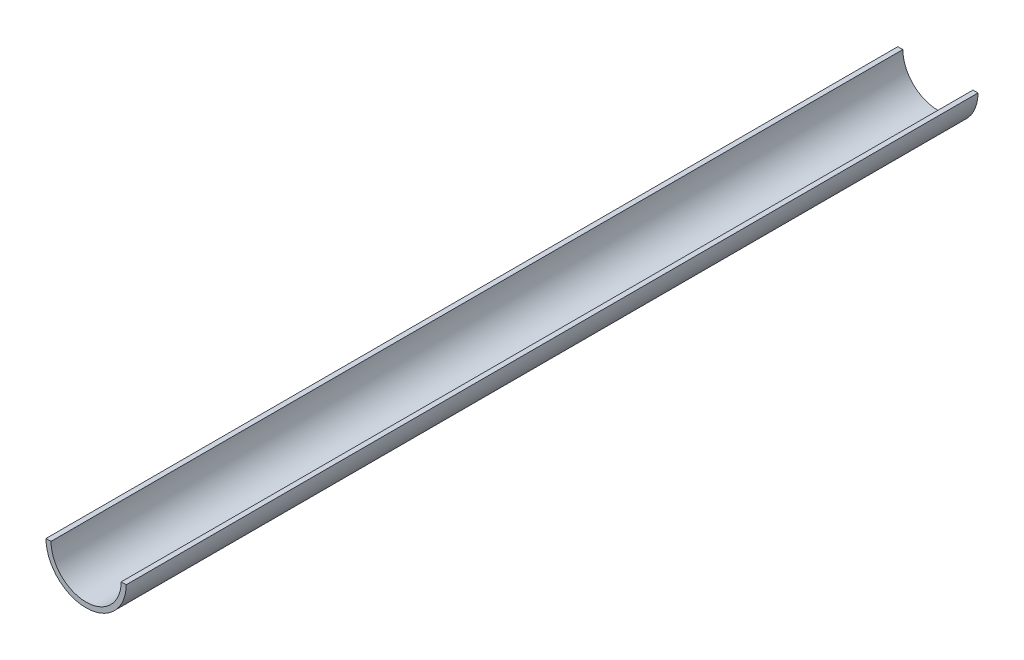
from build123d import *

# Parameters (mm, degrees)
SKETCH1_R           = 25.4
SKETCH1_R_2         = 22.225
BOSS_EXTRUDE1_DEPTH = 914.4
CUT_EXTRUDE1_START  = -539.75
SKETCH2_R           = 25.4
CUT_EXTRUDE1_DEPTH  = 376.35528356
CUT_EXTRUDE3_DEPTH  = 541.943973531


with BuildPart() as part:
    # Sketch1 → Boss-Extrude1 (new body)
    with BuildSketch(Plane.XY):
        Circle(SKETCH1_R)
        Circle(SKETCH1_R_2, mode=Mode.SUBTRACT)
    extrude(amount=BOSS_EXTRUDE1_DEPTH)

    # Sketch2 → Cut-Extrude1 (cut, through all)
    with BuildSketch(Plane(origin=(0, 0, 0), x_dir=(-1, 0, 0), z_dir=(0, 0, -1)).offset(CUT_EXTRUDE1_START)):
        Circle(SKETCH2_R)
    extrude(amount=-CUT_EXTRUDE1_DEPTH, mode=Mode.SUBTRACT)

    # Sketch4 → Cut-Extrude3 (cut, through all)
    with BuildSketch(Plane.XY):
        with BuildLine():
            Line((-25.4, 0), (25.4, 0))
            ThreePointArc((25.4, 0), (0, 25.4), (-25.4, 0))
        make_face()
    extrude(amount=CUT_EXTRUDE3_DEPTH, mode=Mode.SUBTRACT)


solid = part.part
